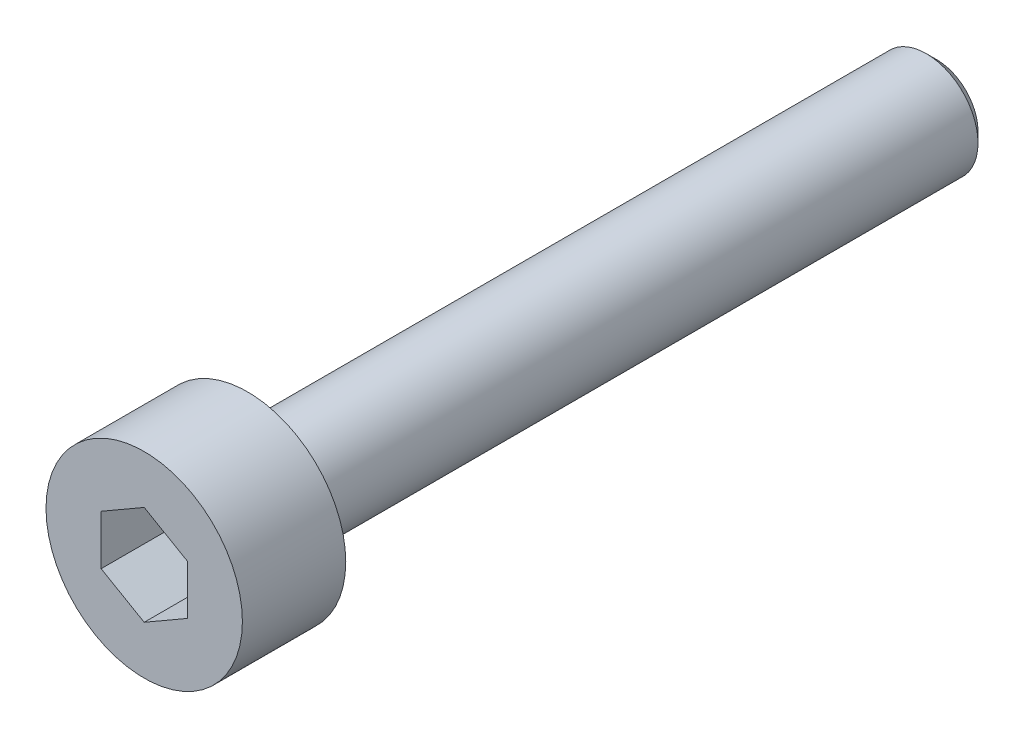
from build123d import *

# Parameters (mm, degrees)
SKETCH1_R           = 2.85
BOSS_EXTRUDE1_DEPTH = 3
SKETCH2_R           = 1.5
BOSS_EXTRUDE2_DEPTH = 20
CHAMFER1_SIZE       = 0.3
CUT_EXTRUDE1_DEPTH  = 2


with BuildPart() as part:
    # Sketch1 → Boss-Extrude1 (new body)
    with BuildSketch(Plane.XY):
        Circle(SKETCH1_R)
    extrude(amount=BOSS_EXTRUDE1_DEPTH)

    # Sketch2 → Boss-Extrude2 (add)
    with BuildSketch(Plane(origin=(0, 0, 0), x_dir=(-1, 0, 0), z_dir=(0, 0, -1))):
        with Locations(Location((0, 0, 0), (0, 0, 180))):
            Circle(SKETCH2_R)
    extrude(amount=BOSS_EXTRUDE2_DEPTH)

    # Chamfer1
    chamfer1_edges = [part.edges().sort_by_distance(p)[0] for p in [
        (-1.5, 0, -20),
    ]]
    chamfer(chamfer1_edges, length=CHAMFER1_SIZE)

    # Sketch3 → Cut-Extrude1 (cut)
    with BuildSketch(Plane.XY.offset(3)):
        Polygon((0, 1.443375673), (-1.25, 0.721687836), (-1.25, -0.721687836), (0, -1.443375673), (1.25, -0.721687836), (1.25, 0.721687836), align=None)
    extrude(amount=-CUT_EXTRUDE1_DEPTH, mode=Mode.SUBTRACT)


solid = part.part
